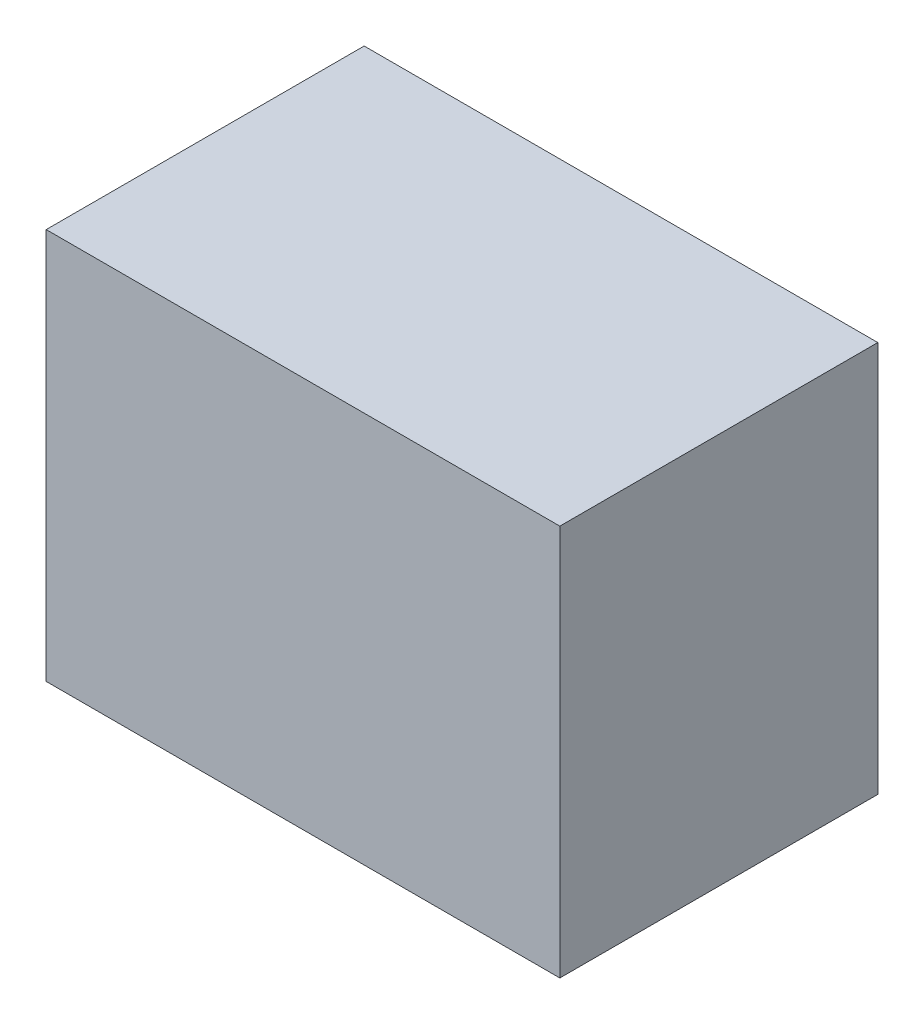
from build123d import *

# Parameters (mm, degrees)
SKETCH1_W           = 420
SKETCH1_H           = 320
SKETCH1_W_2         = 400
SKETCH1_H_2         = 300
BOSS_EXTRUDE1_DEPTH = 250
SKETCH2_W           = 420
SKETCH2_H           = 320
BOSS_EXTRUDE2_DEPTH = 10


with BuildPart() as part:
    # Sketch1 → Boss-Extrude1 (new body)
    with BuildSketch(Plane.XY):
        with Locations((200, -150)):
            Rectangle(SKETCH1_W, SKETCH1_H)
        with Locations((200, -150)):
            Rectangle(SKETCH1_W_2, SKETCH1_H_2, mode=Mode.SUBTRACT)
    extrude(amount=BOSS_EXTRUDE1_DEPTH)

    # Sketch2 → Boss-Extrude2 (add)
    with BuildSketch(Plane.XY.offset(250)):
        with Locations((200, -150)):
            Rectangle(SKETCH2_W, SKETCH2_H)
    extrude(amount=BOSS_EXTRUDE2_DEPTH)


solid = part.part
